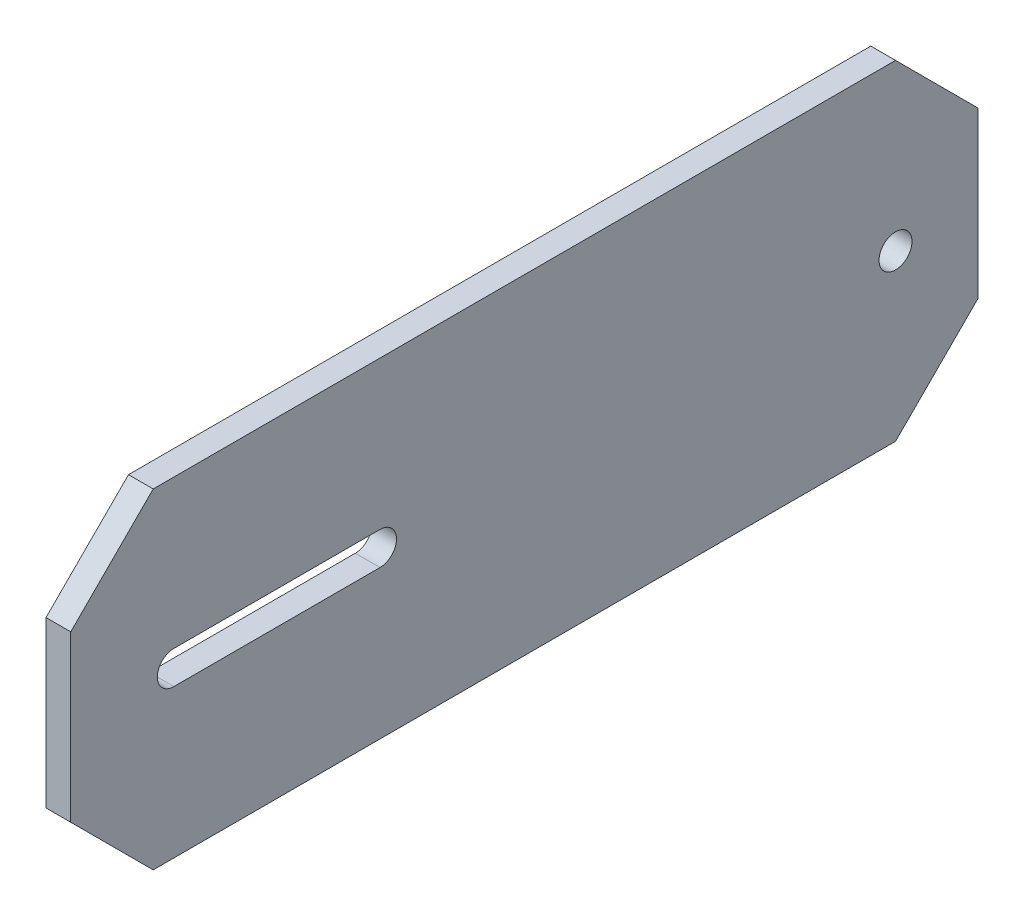
from build123d import *

# Parameters (mm, degrees)
SALIENTE_EXTRUIR1_DEPTH = 3
CROQUIS3_R              = 2
CORTAR_EXTRUIR1_DEPTH   = 9


with BuildPart() as part:
    # Croquis2 → Saliente-Extruir1 (new body)
    with BuildSketch(Plane(origin=(0, 0, 0), x_dir=(0, 0, -1), z_dir=(1, 0, 0))):
        Polygon((0, 0), (90, 0), (100, 10), (100, 30), (90, 40), (0, 40), (-10, 30), (-10, 10), align=None)
    extrude(amount=SALIENTE_EXTRUIR1_DEPTH)

    # Croquis3 → Cortar-Extruir1 (cut)
    with BuildSketch(Plane(origin=(3, 0, 0), x_dir=(0, 0, -1), z_dir=(1, 0, 0))):
        with Locations((90, 20)):
            Circle(CROQUIS3_R)
        with BuildLine():
            Line((2.5, 22), (27.5, 22))
            ThreePointArc((27.5, 22), (29.5, 20), (27.5, 18))
            Line((27.5, 18), (2.5, 18))
            ThreePointArc((2.5, 18), (0.5, 20), (2.5, 22))
        make_face()
    extrude(amount=-CORTAR_EXTRUIR1_DEPTH, mode=Mode.SUBTRACT)


solid = part.part
